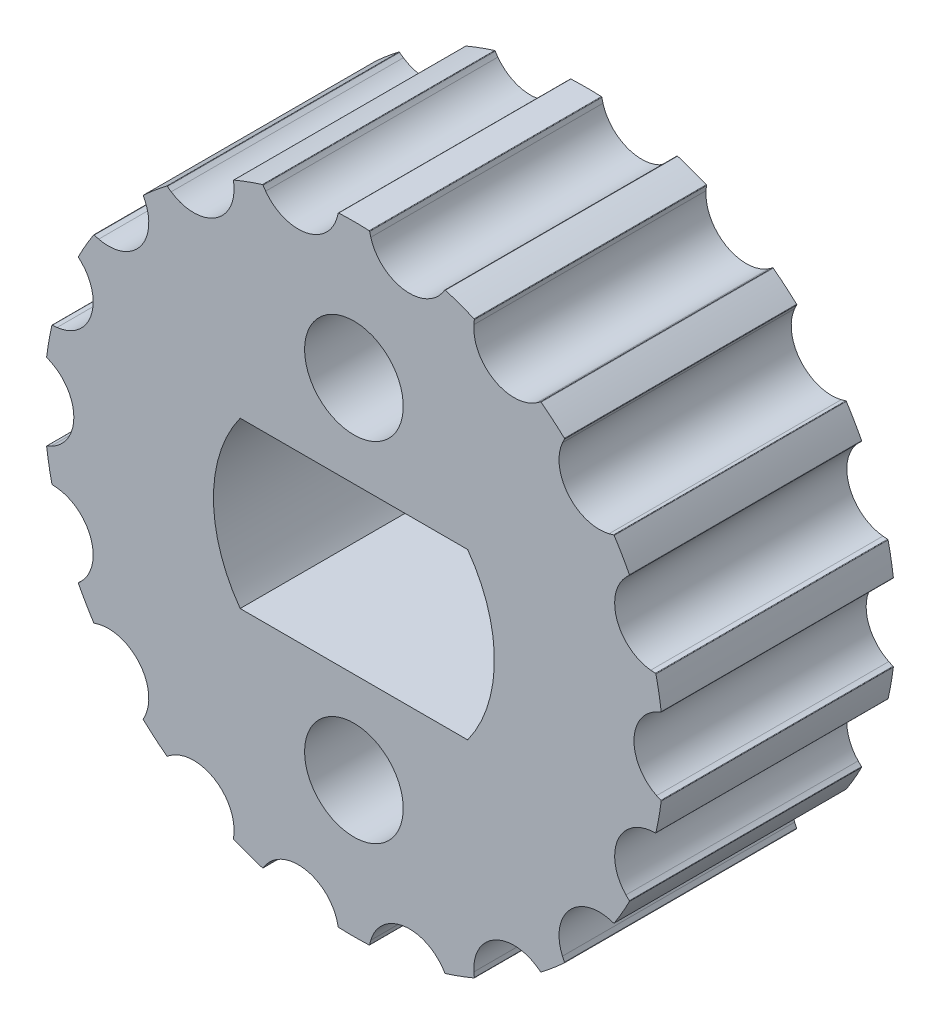
from build123d import *

# Parameters (mm, degrees)
BOSS_EXTRU_1_DEPTH           = 4
R_P_TITION_CIRCULAIRE2_COUNT = 18
ESQUISSE2_R                  = 1
ENL_V_MAT_EXTRU_1_DEPTH      = 9.51423448
ENL_V_MAT_EXTRU_2_DEPTH      = 9.51423448
ESQUISSE6_R                  = 0.85
ENL_V_MAT_EXTRU_3_DEPTH      = 9.51423448


with BuildPart() as part:
    # Esquisse1 → Boss.-Extru.1 (new body)
    with BuildSketch(Plane.XY):
        with BuildLine():
            Line((-0.837844824, 4.751654117), (0, 0))
            Line((0, 0), (0.837844824, 4.751654117))
            ThreePointArc((0.837844824, 4.751654117), (0.493865605, 4.91926699), (0.290736743, 5.24354225))
            ThreePointArc((0.290736743, 5.24354225), (0.280316251, 5.282221889), (0.271261154, 5.321243759))
            ThreePointArc((0.271261154, 5.321243759), (0.267960093, 5.326772635), (0.261972767, 5.32914274))
            ThreePointArc((0.261972767, 5.32914274), (0, 5.335577951), (-0.261972767, 5.32914274))
            ThreePointArc((-0.261972767, 5.32914274), (-0.267960093, 5.326772635), (-0.271261154, 5.321243759))
            ThreePointArc((-0.271261154, 5.321243759), (-0.280316251, 5.282221889), (-0.290736743, 5.24354225))
            ThreePointArc((-0.290736743, 5.24354225), (-0.493865605, 4.91926699), (-0.837844824, 4.751654117))
        make_face()
    boss_extru_1 = extrude(amount=BOSS_EXTRU_1_DEPTH)

    # Répétition circulaire2: Boss.-Extru.1 ×18 about axis
    r_p_tition_circulaire2_axis = Axis((0, 0, 0), (0, 0, 1))
    for i in range(1, R_P_TITION_CIRCULAIRE2_COUNT):
        add(boss_extru_1.rotate(r_p_tition_circulaire2_axis, i * 360 / R_P_TITION_CIRCULAIRE2_COUNT))

    # Esquisse2 → Enlèv. mat.-Extru.1 (cut, through all)
    with BuildSketch(Plane.XY.offset(4)):
        Circle(ESQUISSE2_R)
    extrude(amount=-ENL_V_MAT_EXTRU_1_DEPTH, mode=Mode.SUBTRACT)

    # Esquisse5 → Enlèv. mat.-Extru.2 (cut, through all)
    with BuildSketch(Plane(origin=(0, 0, 0), x_dir=(-1, 0, 0), z_dir=(0, 0, -1))):
        with BuildLine():
            Line((-1.959591794, -1.42), (1.959591794, -1.42))
            ThreePointArc((1.959591794, -1.42), (2.42, 0), (1.959591794, 1.42))
            Line((1.959591794, 1.42), (-1.959591794, 1.42))
            ThreePointArc((-1.959591794, 1.42), (-2.42, 0), (-1.959591794, -1.42))
        make_face()
    extrude(amount=-ENL_V_MAT_EXTRU_2_DEPTH, mode=Mode.SUBTRACT)

    # Esquisse6 → Enlèv. mat.-Extru.3 (cut, through all)
    with BuildSketch(Plane(origin=(0, 0, 0), x_dir=(-1, 0, 0), z_dir=(0, 0, -1))):
        with Locations((0, 3)):
            Circle(ESQUISSE6_R)
        with Locations((0, -3)):
            Circle(ESQUISSE6_R)
    extrude(amount=-ENL_V_MAT_EXTRU_3_DEPTH, mode=Mode.SUBTRACT)


solid = part.part
